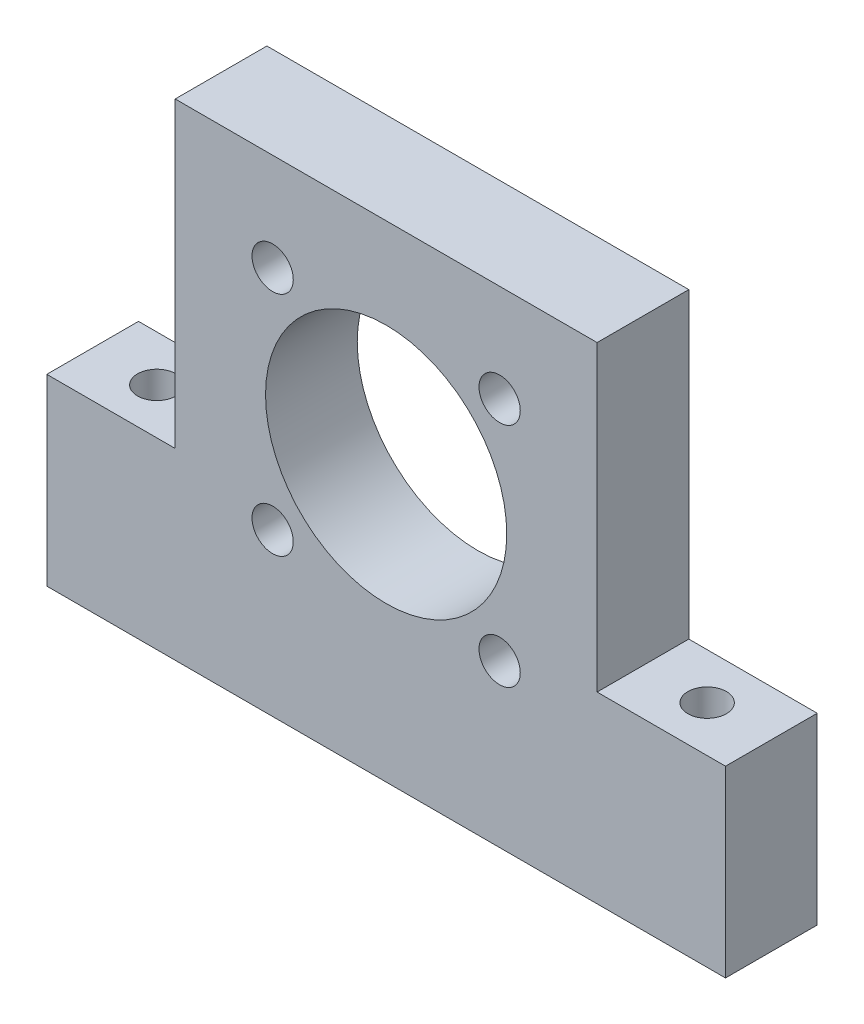
from build123d import *

# Parameters (mm, degrees)
ESQUISSE1_R             = 13.15
BOSS_EXTRU_1_DEPTH      = 10
ENL_V_MAT_EXTRU_2_REACH = 67.406
ESQUISSE5_R             = 2.1
SKETCH1_R               = 2.25
CUT_EXTRUDE1_DEPTH      = 49.672374095
CIRPATTERN1_COUNT       = 4


with BuildPart() as part:
    # Esquisse1 → Boss.-Extru.1 (new body)
    with BuildSketch(Plane.XY):
        Polygon((-23, 23), (23, 23), (23, -10), (37, -10), (37, -30), (-37, -30), (-37, -10), (-23, -10), align=None)
        Circle(ESQUISSE1_R, mode=Mode.SUBTRACT)
    extrude(amount=BOSS_EXTRU_1_DEPTH)

    # Esquisse5 → Enlèv. mat.-Extru.2 (cut, up to next)
    with BuildSketch(Plane.XZ.offset(30), mode=Mode.PRIVATE) as enl_v_mat_extru_2_sk1:
        with Locations(Location((-30, 5, 0), (0, 0, 270))):
            Circle(ESQUISSE5_R)
    enl_v_mat_extru_2_tool1 = extrude(enl_v_mat_extru_2_sk1.sketch, amount=-ENL_V_MAT_EXTRU_2_REACH, mode=Mode.PRIVATE) & part.part
    # Esquisse5 → Enlèv. mat.-Extru.2 (cut, up to next)
    with BuildSketch(Plane.XZ.offset(30), mode=Mode.PRIVATE) as enl_v_mat_extru_2_sk2:
        with Locations(Location((30, 5, 0), (0, 0, 270))):
            Circle(ESQUISSE5_R)
    enl_v_mat_extru_2_tool2 = extrude(enl_v_mat_extru_2_sk2.sketch, amount=-ENL_V_MAT_EXTRU_2_REACH, mode=Mode.PRIVATE) & part.part
    add(enl_v_mat_extru_2_tool1.solids().sort_by_distance((-30, -30, 5))[0], mode=Mode.SUBTRACT)
    add(enl_v_mat_extru_2_tool2.solids().sort_by_distance((30, -30, 5))[0], mode=Mode.SUBTRACT)

    # Sketch1 → Cut-Extrude1 (cut, through all)
    with BuildSketch(Plane.XY.offset(10)):
        with Locations((12.374368671, 12.374368671)):
            Circle(SKETCH1_R)
    cut_extrude1 = extrude(amount=-CUT_EXTRUDE1_DEPTH, mode=Mode.SUBTRACT)

    # CirPattern1: Cut-Extrude1 ×4 about axis
    cirpattern1_axis = Axis((0, 0, 0), (0, 0, 1))
    for i in range(1, CIRPATTERN1_COUNT):
        add(cut_extrude1.rotate(cirpattern1_axis, i * 360 / CIRPATTERN1_COUNT), mode=Mode.SUBTRACT)


solid = part.part
